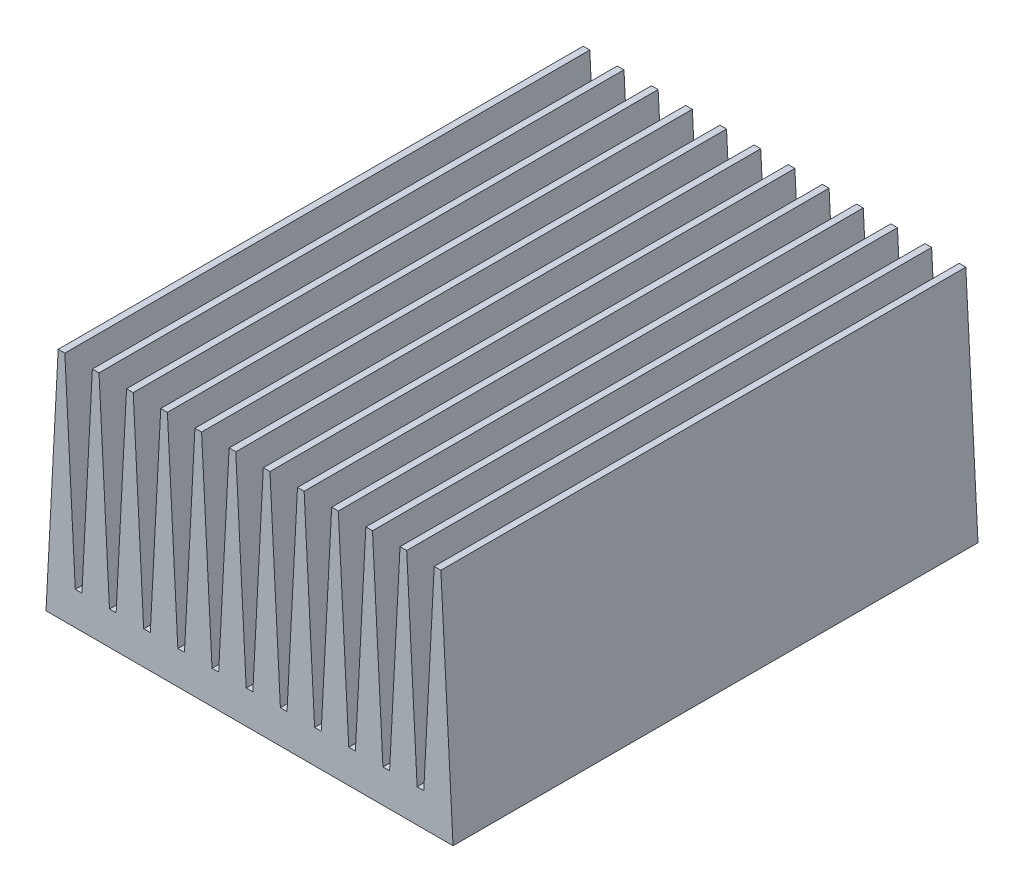
from build123d import *

# Parameters (mm, degrees)
BOSS_EXTRUDE1_DEPTH = 39.5


with BuildPart() as part:
    # Sketch1 → Boss-Extrude1 (new, symmetric)
    with BuildSketch(Plane.XY):
        Polygon((0, 0), (1.834272275, 35), (2.834272275, 35), (4.406505653, 5), (5.406505653, 5), (6.978739032, 35), (7.978739032, 35), (9.55097241, 5), (10.55097241, 5), (12.123205789, 35), (13.123205789, 35), (14.695439167, 5), (15.695439167, 5), (17.267672546, 35), (18.267672546, 35), (19.839905924, 5), (20.839905924, 5), (22.412139303, 35), (23.412139303, 35), (24.984372681, 5), (25.984372681, 5), (27.55660606, 35), (28.55660606, 35), (30.128839438, 5), (31.128839438, 5), (32.701072817, 35), (33.701072817, 35), (35.273306195, 5), (36.273306195, 5), (37.845539574, 35), (38.845539574, 35), (40.417772952, 5), (41.417772952, 5), (42.990006331, 35), (43.990006331, 35), (45.562239709, 5), (46.562239709, 5), (48.134473088, 35), (49.134473088, 35), (50.706706466, 5), (51.706706466, 5), (53.278939845, 35), (54.278939845, 35), (55.851173223, 5), (56.851173223, 5), (58.423406602, 35), (59.423406602, 35), (61.257678877, 0), align=None)
    extrude(amount=BOSS_EXTRUDE1_DEPTH, both=True)


solid = part.part
